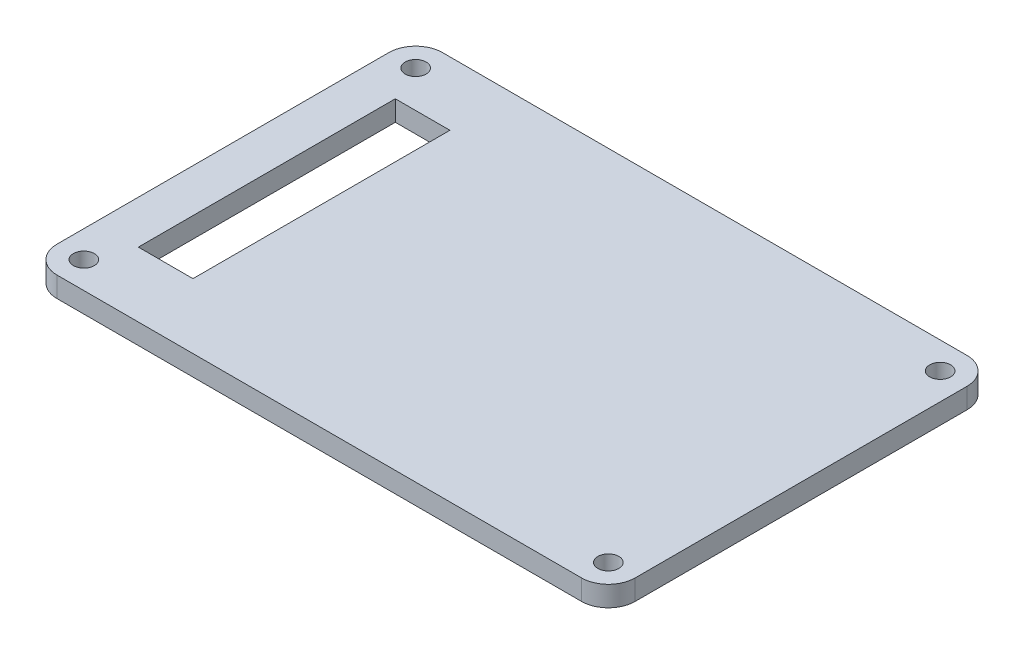
from build123d import *

# Parameters (mm, degrees)
SKETCH2_R           = 1.63195
BOSS_EXTRUDE3_DEPTH = 3.175
SKETCH3_W           = 8.5
SKETCH3_H           = 40
CUT_EXTRUDE1_DEPTH  = 55.176384385


with BuildPart() as part:
    # Sketch2 → Boss-Extrude3 (new body)
    with BuildSketch(Plane(origin=(0, 0, 0), x_dir=(1, 0, 0), z_dir=(0, 1, 0))):
        with BuildLine():
            Line((-45, 25.825), (-45, -25.825))
            ThreePointArc((-45, -25.825), (-43.777170811, -28.777170811), (-40.825, -30))
            Line((-40.825, -30), (40.825, -30))
            ThreePointArc((40.825, -30), (43.777170811, -28.777170811), (45, -25.825))
            Line((45, -25.825), (45, 25.825))
            ThreePointArc((45, 25.825), (43.777170811, 28.777170811), (40.825, 30))
            Line((40.825, 30), (-40.825, 30))
            ThreePointArc((-40.825, 30), (-43.777170811, 28.777170811), (-45, 25.825))
        make_face()
        with Locations(Location((40.825, 25.825, 0), (0, 0, 270))):
            Circle(SKETCH2_R, mode=Mode.SUBTRACT)
        with Locations(Location((40.825, -25.825, 0), (0, 0, 270))):
            Circle(SKETCH2_R, mode=Mode.SUBTRACT)
        with Locations(Location((-40.825, 25.825, 0), (0, 0, 270))):
            Circle(SKETCH2_R, mode=Mode.SUBTRACT)
        with Locations(Location((-40.825, -25.825, 0), (0, 0, 270))):
            Circle(SKETCH2_R, mode=Mode.SUBTRACT)
    extrude(amount=BOSS_EXTRUDE3_DEPTH)

    # Sketch3 → Cut-Extrude1 (cut, through all)
    with BuildSketch(Plane(origin=(0, 3.175, 0), x_dir=(1, 0, 0), z_dir=(0, 1, 0))):
        with Locations((-34.015313808, 0.1)):
            Rectangle(SKETCH3_W, SKETCH3_H)
    extrude(amount=-CUT_EXTRUDE1_DEPTH, mode=Mode.SUBTRACT)


solid = part.part
